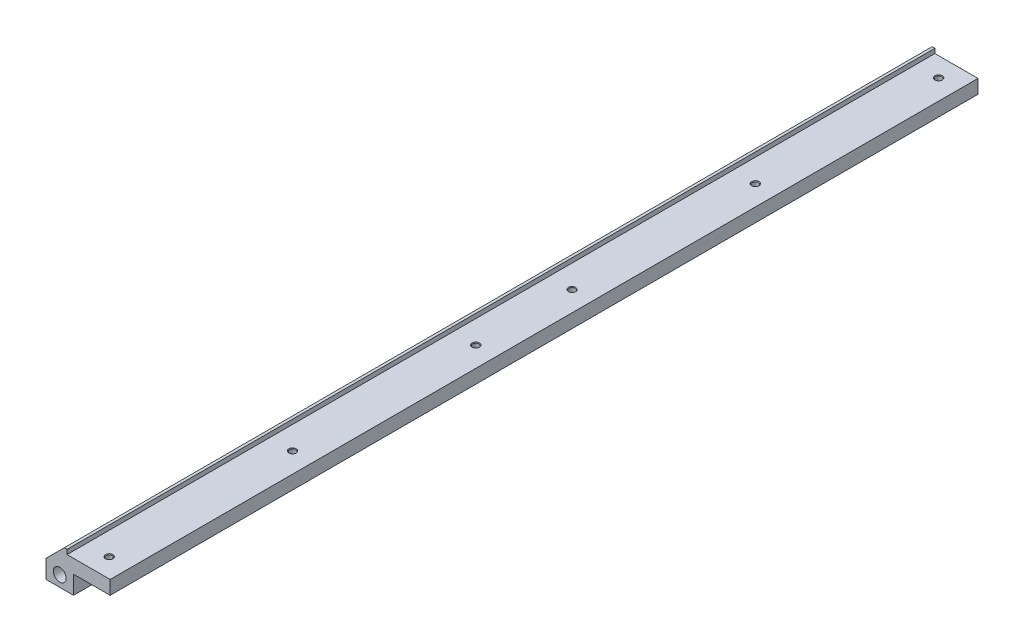
from build123d import *

# Parameters (mm, degrees)
LINEAR_AUSTRAGEN1_DEPTH              = 473.5
M8_GEWINDEBOHRUNG1_D                 = 6.8
M8_GEWINDEBOHRUNG1_CSINK_D           = 8.05
M8_GEWINDEBOHRUNG1_CSINK_ANGLE       = 90
SCHNITT_LINEAR_AUSTRAGEN2_DEPTH      = 20
FASE1_SIZE                           = 20
F_14_0_14_DURCHMESSER_BOHRUNG1_D     = 14
F_14_0_14_DURCHMESSER_BOHRUNG1_DEPTH = 20
F_14_0_14_DURCHMESSER_BOHRUNG1_TIP   = 4.206024333
F_14_0_14_DURCHMESSER_BOHRUNG2_D     = 14
F_14_0_14_DURCHMESSER_BOHRUNG2_DEPTH = 20
F_14_0_14_DURCHMESSER_BOHRUNG2_TIP   = 4.206024333


with BuildPart() as part:
    # Skizze1 → Linear austragen1 (new, symmetric)
    with BuildSketch(Plane.XY):
        Polygon((8, 28), (8, 23), (55, 23), (55, -12), (-15, -12), (-15, 28), align=None)
    extrude(amount=LINEAR_AUSTRAGEN1_DEPTH, both=True)

    # M8 Gewindebohrung1 (through all)
    with Locations(Plane(origin=(0, 23, 0), x_dir=(-1, 0, 0), z_dir=(0, 1, 0))):
        with Locations((-33, 452.5), (-33, -52.5), (-33, 252.5), (-33, -252.5), (-33, 52.5), (-33, -452.5)):
            CounterSinkHole(M8_GEWINDEBOHRUNG1_D / 2, M8_GEWINDEBOHRUNG1_CSINK_D / 2, counter_sink_angle=M8_GEWINDEBOHRUNG1_CSINK_ANGLE)

    # Skizze20 → Schnitt-Linear austragen2 (cut)
    with BuildSketch(Plane.XZ.offset(12)):
        with BuildLine():
            Line((55, 473.5), (15, 473.5))
            Line((15, 473.5), (15, 373.5))
            Line((15, 373.5), (11, 373.5))
            ThreePointArc((11, 373.5), (-3.849242405, 367.349242405), (-10, 352.5))
            Line((-10, 352.5), (-10, -352.5))
            ThreePointArc((-10, -352.5), (-3.849242405, -367.349242405), (11, -373.5))
            Line((11, -373.5), (15, -373.5))
            Line((15, -373.5), (15, -473.5))
            Line((15, -473.5), (55, -473.5))
            Line((55, -473.5), (55, 473.5))
        make_face()
    extrude(amount=-SCHNITT_LINEAR_AUSTRAGEN2_DEPTH, mode=Mode.SUBTRACT)

    # Fase1
    fase1_edges = [part.edges().sort_by_distance(p)[0] for p in [
        (-15, 28, 0),
    ]]
    chamfer(fase1_edges, length=FASE1_SIZE)

    # Ø14.0 (14) Durchmesser Bohrung1
    with Locations(Plane.XY.offset(473.5)):
        with Locations((0, 0)):
            Hole(F_14_0_14_DURCHMESSER_BOHRUNG1_D / 2, depth=F_14_0_14_DURCHMESSER_BOHRUNG1_DEPTH)
            with Locations((0, 0, -(F_14_0_14_DURCHMESSER_BOHRUNG1_DEPTH + F_14_0_14_DURCHMESSER_BOHRUNG1_TIP / 2))):  # 118° drill point
                Cone(0, F_14_0_14_DURCHMESSER_BOHRUNG1_D / 2, F_14_0_14_DURCHMESSER_BOHRUNG1_TIP, mode=Mode.SUBTRACT)

    # Ø14.0 (14) Durchmesser Bohrung2
    with Locations(Plane(origin=(0, 0, -473.5), x_dir=(-1, 0, 0), z_dir=(0, 0, -1))):
        with Locations((0, 0)):
            Hole(F_14_0_14_DURCHMESSER_BOHRUNG2_D / 2, depth=F_14_0_14_DURCHMESSER_BOHRUNG2_DEPTH)
            with Locations((0, 0, -(F_14_0_14_DURCHMESSER_BOHRUNG2_DEPTH + F_14_0_14_DURCHMESSER_BOHRUNG2_TIP / 2))):  # 118° drill point
                Cone(0, F_14_0_14_DURCHMESSER_BOHRUNG2_D / 2, F_14_0_14_DURCHMESSER_BOHRUNG2_TIP, mode=Mode.SUBTRACT)


solid = part.part
